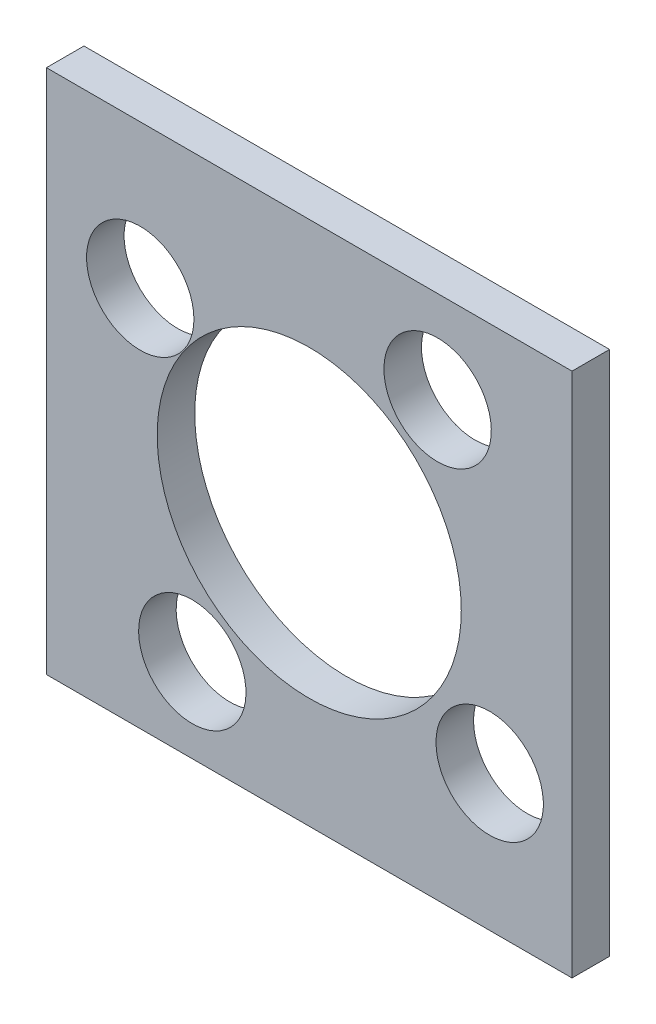
from build123d import *

# Parameters (mm, degrees)
SKETCH1_W           = 140
SKETCH1_H           = 140
BOSS_EXTRUDE1_DEPTH = 10
SKETCH2_R           = 14.3
CUT_EXTRUDE4_DEPTH  = 100.498743711
CIRPATTERN4_COUNT   = 4
SKETCH4_R           = 40.5
CUT_EXTRUDE5_DEPTH  = 100.498743711


with BuildPart() as part:
    # Sketch1 → Boss-Extrude1 (new body)
    with BuildSketch(Plane.XY):
        Rectangle(SKETCH1_W, SKETCH1_H)
    extrude(amount=BOSS_EXTRUDE1_DEPTH)

    # Sketch2 → Cut-Extrude4 (cut, through all)
    with BuildSketch(Plane.XY.offset(10)):
        with Locations((-45.016044425, 31.599932663)):
            Circle(SKETCH2_R)
    cut_extrude4 = extrude(amount=-CUT_EXTRUDE4_DEPTH, mode=Mode.SUBTRACT)

    # CirPattern4: Cut-Extrude4 ×4 about axis
    cirpattern4_axis = Axis((1.525479863, -1.070841776, 0), (0, 0, 1))
    for i in range(1, CIRPATTERN4_COUNT):
        add(cut_extrude4.rotate(cirpattern4_axis, i * 360 / CIRPATTERN4_COUNT), mode=Mode.SUBTRACT)

    # Sketch4 → Cut-Extrude5 (cut, through all)
    with BuildSketch(Plane.XY.offset(10)):
        Circle(SKETCH4_R)
    extrude(amount=-CUT_EXTRUDE5_DEPTH, mode=Mode.SUBTRACT)


solid = part.part
